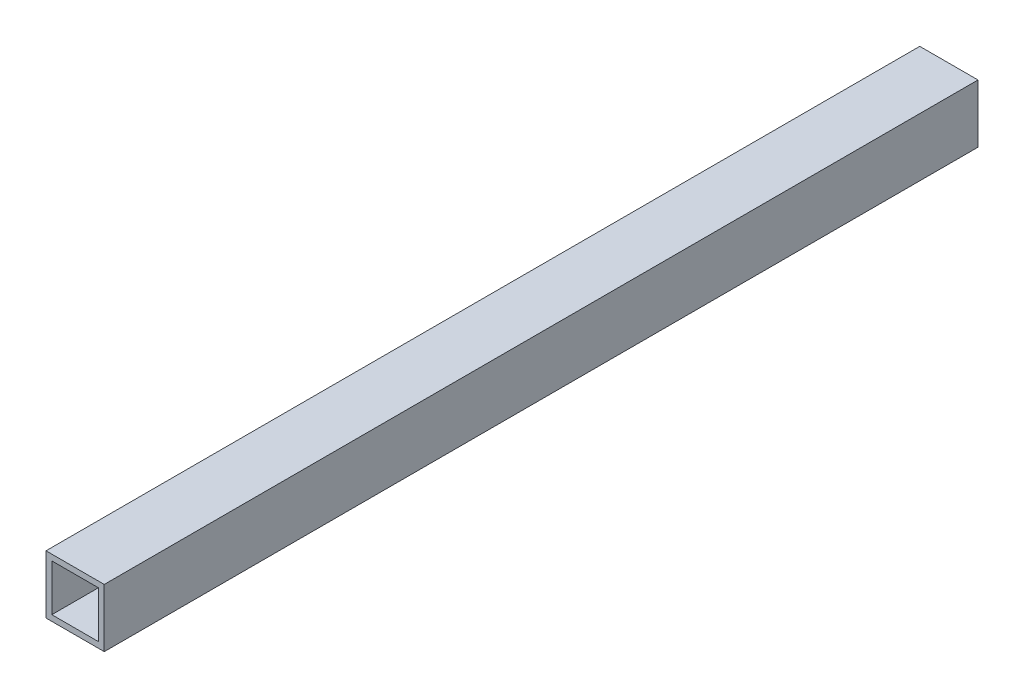
from build123d import *

# Parameters (mm, degrees)
SKETCH_1_W      = 10
SKETCH_1_H      = 10
SKETCH_1_W_2    = 8
SKETCH_1_H_2    = 8
EXTRUDE_1_DEPTH = 150


with BuildPart() as part:
    # 草图1 → 凸台-拉伸1 (new body)
    with BuildSketch(Plane.XY):
        Rectangle(SKETCH_1_W, SKETCH_1_H)
        Rectangle(SKETCH_1_W_2, SKETCH_1_H_2, mode=Mode.SUBTRACT)
    extrude(amount=EXTRUDE_1_DEPTH)


solid = part.part
